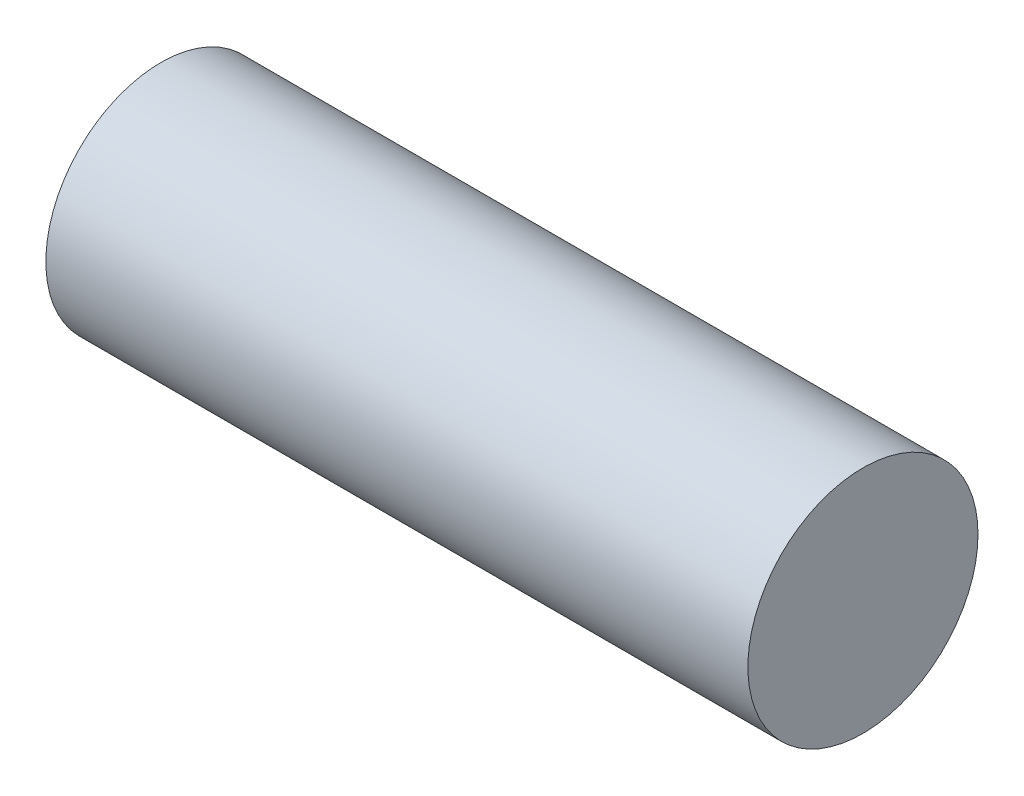
from build123d import *

# Parameters (mm, degrees)
SKETCH1_R           = 2.95
BOSS_EXTRUDE1_DEPTH = 18


with BuildPart() as part:
    # Sketch1 → Boss-Extrude1 (new body)
    with BuildSketch(Plane(origin=(0, 0, 0), x_dir=(0, 0, -1), z_dir=(1, 0, 0))):
        Circle(SKETCH1_R)
    extrude(amount=BOSS_EXTRUDE1_DEPTH)


solid = part.part
